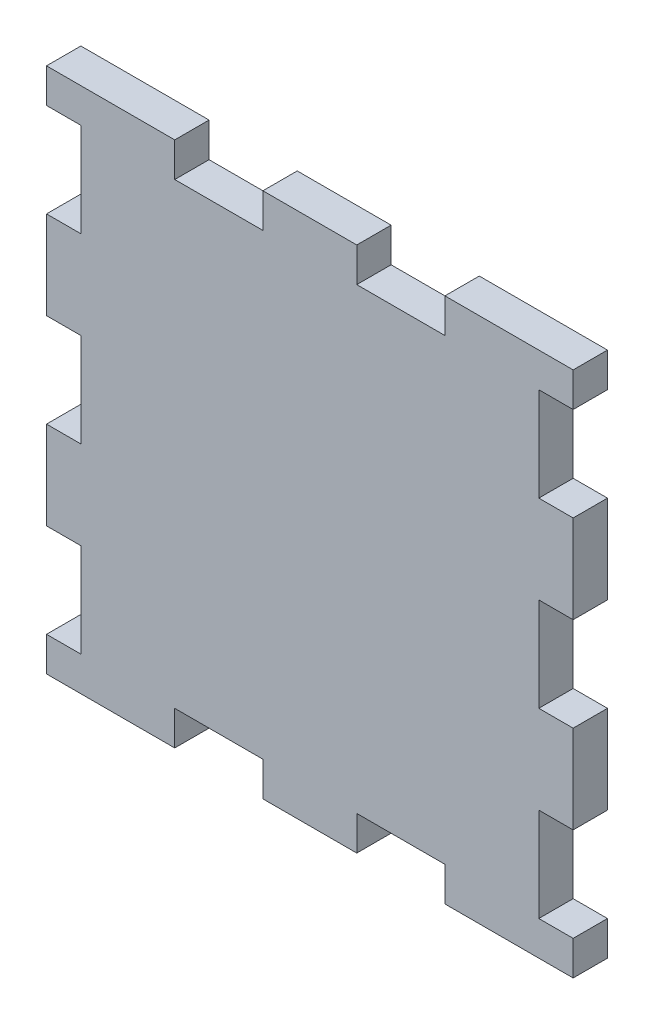
from build123d import *

# Parameters (mm, degrees)
CROQUIS1_W              = 8.2
CROQUIS1_H              = 3
CROQUIS1_W_2            = 3
CROQUIS1_H_2            = 7.7
CROQUIS1_W_3            = 40
CROQUIS1_H_3            = 40
SALIENTE_EXTRUIR1_DEPTH = 3


with BuildPart() as part:
    # Croquis1 → Saliente-Extruir1 (new body)
    with BuildSketch(Plane.XY):
        Polygon((-20, 20), (-11.8, 20), (-11.8, 23), (-23, 23), (-23, 20), align=None)
        with Locations((0, 21.5)):
            Rectangle(CROQUIS1_W, CROQUIS1_H)
        Polygon((11.8, 20), (20, 20), (23, 20), (23, 23), (11.8, 23), align=None)
        with Locations((21.5, 7.95)):
            Rectangle(CROQUIS1_W_2, CROQUIS1_H_2)
        with Locations((21.5, -7.95)):
            Rectangle(CROQUIS1_W_2, CROQUIS1_H_2)
        Polygon((23, -20), (20, -20), (11.8, -20), (11.8, -23), (23, -23), align=None)
        with Locations((0, -21.5)):
            Rectangle(CROQUIS1_W, CROQUIS1_H)
        Polygon((-11.8, -23), (-11.8, -20), (-20, -20), (-23, -20), (-23, -23), align=None)
        with Locations((-21.5, 7.95)):
            Rectangle(CROQUIS1_W_2, CROQUIS1_H_2)
        Rectangle(CROQUIS1_W_3, CROQUIS1_H_3)
        with Locations((-21.5, -7.95)):
            Rectangle(CROQUIS1_W_2, CROQUIS1_H_2)
    extrude(amount=SALIENTE_EXTRUIR1_DEPTH)


solid = part.part
